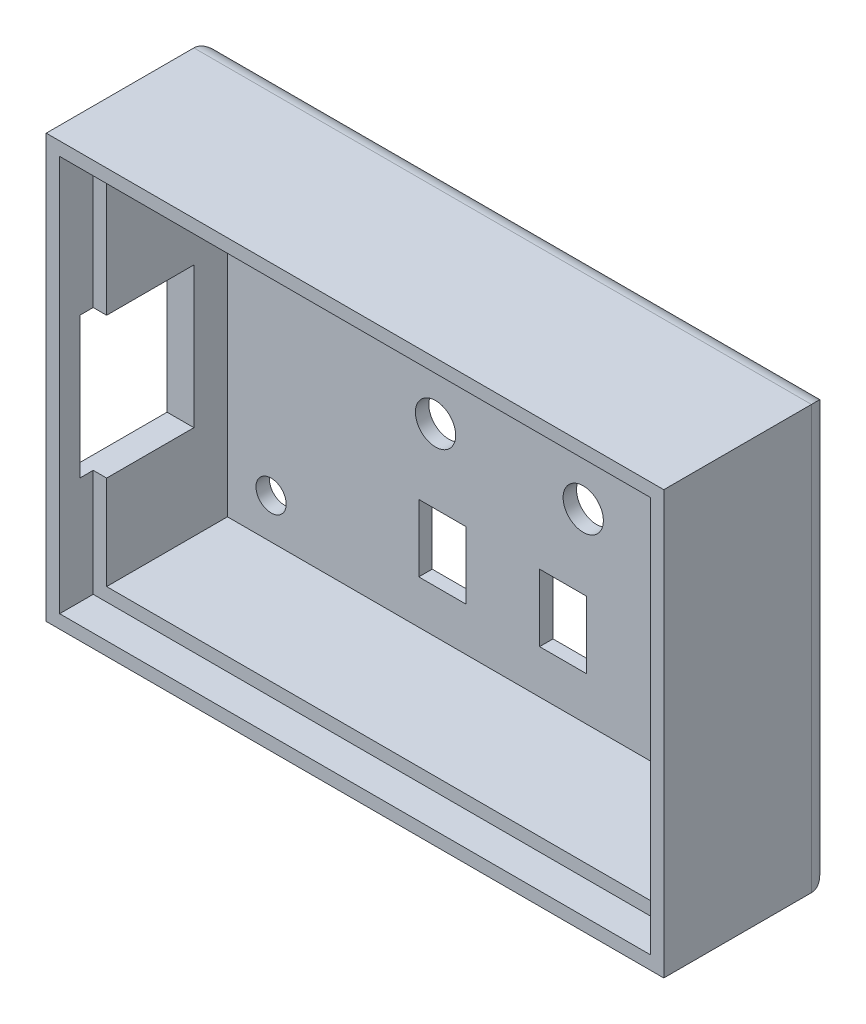
from build123d import *

# Parameters (mm, degrees)
SKETCH3_W           = 92
SKETCH3_H           = 63
SKETCH3_R           = 3
SKETCH3_R_2         = 2.25
SKETCH3_W_2         = 7
SKETCH3_H_2         = 10
BOSS_EXTRUDE3_DEPTH = 25
SKETCH4_W           = 84
SKETCH4_H           = 55
CUT_EXTRUDE1_DEPTH  = 23
SKETCH5_W           = 88
SKETCH5_H           = 59
CUT_EXTRUDE2_DEPTH  = 5
FILLET1_R           = 3
SKETCH6_W           = 15
SKETCH6_H           = 21
CUT_EXTRUDE3_DEPTH  = 5


with BuildPart() as part:
    # Sketch3 → Boss-Extrude3 (new body)
    with BuildSketch(Plane.XY):
        with Locations((46, 31.5)):
            Rectangle(SKETCH3_W, SKETCH3_H)
        with Locations((35, 31.5)):
            Circle(SKETCH3_R, mode=Mode.SUBTRACT)
        with Locations((57, 31.5)):
            Circle(SKETCH3_R, mode=Mode.SUBTRACT)
        with Locations((77, 31.5)):
            Circle(SKETCH3_R, mode=Mode.SUBTRACT)
        with Locations((82, 53)):
            Circle(SKETCH3_R_2, mode=Mode.SUBTRACT)
        with Locations((82, 10)):
            Circle(SKETCH3_R_2, mode=Mode.SUBTRACT)
        with Locations((10.5, 10)):
            Circle(SKETCH3_R_2, mode=Mode.SUBTRACT)
        with Locations((10.5, 53)):
            Circle(SKETCH3_R_2, mode=Mode.SUBTRACT)
        with Locations((71.5, 15.5)):
            Rectangle(SKETCH3_W_2, SKETCH3_H_2, mode=Mode.SUBTRACT)
        with Locations((54, 15.5)):
            Rectangle(SKETCH3_W_2, SKETCH3_H_2, mode=Mode.SUBTRACT)
        with Locations((36, 15.5)):
            Rectangle(SKETCH3_W_2, SKETCH3_H_2, mode=Mode.SUBTRACT)
    extrude(amount=BOSS_EXTRUDE3_DEPTH)

    # Sketch4 → Cut-Extrude1 (cut)
    with BuildSketch(Plane.XY.offset(25)):
        with Locations((46, 31.5)):
            Rectangle(SKETCH4_W, SKETCH4_H)
    extrude(amount=-CUT_EXTRUDE1_DEPTH, mode=Mode.SUBTRACT)

    # Sketch5 → Cut-Extrude2 (cut)
    with BuildSketch(Plane.XY.offset(25)):
        with Locations((46, 31.5)):
            Rectangle(SKETCH5_W, SKETCH5_H)
    extrude(amount=-CUT_EXTRUDE2_DEPTH, mode=Mode.SUBTRACT)

    # Fillet1
    fillet1_edges = [part.edges().sort_by_distance(p)[0] for p in [
        (0, 31.5, 0),
        (46, 63, 0),
        (92, 31.5, 0),
        (46, 0, 0),
    ]]
    fillet(fillet1_edges, radius=FILLET1_R)

    # Sketch6 → Cut-Extrude3 (cut)
    with BuildSketch(Plane.ZY):
        with Locations((14.5, 28.5)):
            Rectangle(SKETCH6_W, SKETCH6_H)
    extrude(amount=-CUT_EXTRUDE3_DEPTH, mode=Mode.SUBTRACT)


solid = part.part
